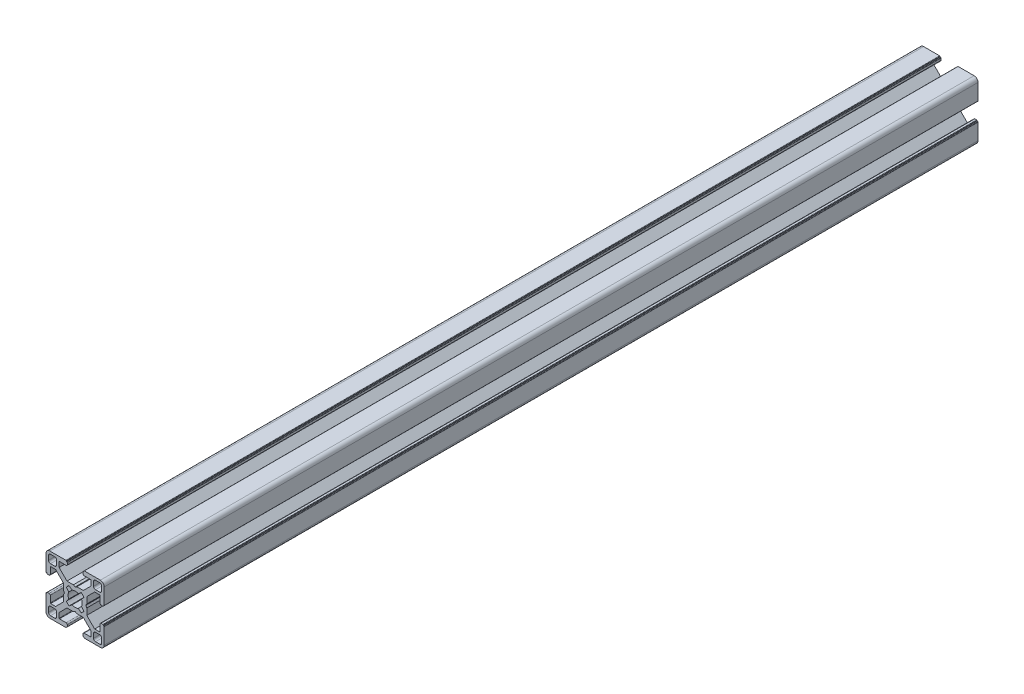
from build123d import *

# Parameters (mm, degrees)
DODANIE_WYCI_GNI_CIE1_DEPTH = 225


with BuildPart() as part:
    # Szkic1 → Dodanie-wyciągnięcie1 (new, symmetric)
    with BuildSketch(Plane.XY):
        with BuildLine():
            Line((0, -5.48), (0.90066642, -6))
            Line((0.90066642, -6), (4.203948776, -6))
            Line((4.203948776, -6), (8.25, -10.046051224))
            Line((8.25, -10.046051224), (8.25, -12.6))
            ThreePointArc((8.25, -12.6), (8.191421356, -12.741421356), (8.05, -12.8))
            Line((8.05, -12.8), (4.65, -12.8))
            ThreePointArc((4.65, -12.8), (4.225735931, -12.975735931), (4.05, -13.4))
            Line((4.05, -13.4), (4.05, -14.3))
            ThreePointArc((4.05, -14.3), (4.108578644, -14.441421356), (4.25, -14.5))
            Line((4.25, -14.5), (4.35, -14.5))
            ThreePointArc((4.35, -14.5), (4.491421356, -14.558578644), (4.55, -14.7))
            Line((4.55, -14.7), (4.55, -14.8))
            ThreePointArc((4.55, -14.8), (4.608578644, -14.941421356), (4.75, -15))
            Line((4.75, -15), (13, -15))
            ThreePointArc((13, -15), (14.414213562, -14.414213562), (15, -13))
            Line((15, -13), (15, -4.75))
            ThreePointArc((15, -4.75), (14.941421356, -4.608578644), (14.8, -4.55))
            Line((14.8, -4.55), (14.7, -4.55))
            ThreePointArc((14.7, -4.55), (14.558578644, -4.491421356), (14.5, -4.35))
            Line((14.5, -4.35), (14.5, -4.25))
            ThreePointArc((14.5, -4.25), (14.441421356, -4.108578644), (14.3, -4.05))
            Line((14.3, -4.05), (13.4, -4.05))
            ThreePointArc((13.4, -4.05), (12.975735931, -4.225735931), (12.8, -4.65))
            Line((12.8, -4.65), (12.8, -8.05))
            ThreePointArc((12.8, -8.05), (12.741421356, -8.191421356), (12.6, -8.25))
            Line((12.6, -8.25), (10.046051224, -8.25))
            Line((10.046051224, -8.25), (6, -4.203948776))
            Line((6, -4.203948776), (6, -0.90066642))
            Line((6, -0.90066642), (5.48, 0))
            Line((5.48, 0), (6, 0.90066642))
            Line((6, 0.90066642), (6, 4.203948776))
            Line((6, 4.203948776), (10.046051224, 8.25))
            Line((10.046051224, 8.25), (12.6, 8.25))
            ThreePointArc((12.6, 8.25), (12.741421356, 8.191421356), (12.8, 8.05))
            Line((12.8, 8.05), (12.8, 4.65))
            ThreePointArc((12.8, 4.65), (12.975735931, 4.225735931), (13.4, 4.05))
            Line((13.4, 4.05), (14.3, 4.05))
            ThreePointArc((14.3, 4.05), (14.441421356, 4.108578644), (14.5, 4.25))
            Line((14.5, 4.25), (14.5, 4.35))
            ThreePointArc((14.5, 4.35), (14.558578644, 4.491421356), (14.7, 4.55))
            Line((14.7, 4.55), (14.8, 4.55))
            ThreePointArc((14.8, 4.55), (14.941421356, 4.608578644), (15, 4.75))
            Line((15, 4.75), (15, 13))
            ThreePointArc((15, 13), (14.414213562, 14.414213562), (13, 15))
            Line((13, 15), (4.75, 15))
            ThreePointArc((4.75, 15), (4.608578644, 14.941421356), (4.55, 14.8))
            Line((4.55, 14.8), (4.55, 14.7))
            ThreePointArc((4.55, 14.7), (4.491421356, 14.558578644), (4.35, 14.5))
            Line((4.35, 14.5), (4.25, 14.5))
            ThreePointArc((4.25, 14.5), (4.108578644, 14.441421356), (4.05, 14.3))
            Line((4.05, 14.3), (4.05, 13.4))
            ThreePointArc((4.05, 13.4), (4.225735931, 12.975735931), (4.65, 12.8))
            Line((4.65, 12.8), (8.05, 12.8))
            ThreePointArc((8.05, 12.8), (8.191421356, 12.741421356), (8.25, 12.6))
            Line((8.25, 12.6), (8.25, 10.046051224))
            Line((8.25, 10.046051224), (4.203948776, 6))
            Line((4.203948776, 6), (0.90066642, 6))
            Line((0.90066642, 6), (0, 5.48))
            Line((0, 5.48), (-0.90066642, 6))
            Line((-0.90066642, 6), (-4.203948776, 6))
            Line((-4.203948776, 6), (-8.25, 10.046051224))
            Line((-8.25, 10.046051224), (-8.25, 12.6))
            ThreePointArc((-8.25, 12.6), (-8.191421356, 12.741421356), (-8.05, 12.8))
            Line((-8.05, 12.8), (-4.65, 12.8))
            ThreePointArc((-4.65, 12.8), (-4.225735931, 12.975735931), (-4.05, 13.4))
            Line((-4.05, 13.4), (-4.05, 14.3))
            ThreePointArc((-4.05, 14.3), (-4.108578644, 14.441421356), (-4.25, 14.5))
            Line((-4.25, 14.5), (-4.35, 14.5))
            ThreePointArc((-4.35, 14.5), (-4.491421356, 14.558578644), (-4.55, 14.7))
            Line((-4.55, 14.7), (-4.55, 14.8))
            ThreePointArc((-4.55, 14.8), (-4.608578644, 14.941421356), (-4.75, 15))
            Line((-4.75, 15), (-13, 15))
            ThreePointArc((-13, 15), (-14.414213562, 14.414213562), (-15, 13))
            Line((-15, 13), (-15, 4.75))
            ThreePointArc((-15, 4.75), (-14.941421356, 4.608578644), (-14.8, 4.55))
            Line((-14.8, 4.55), (-14.7, 4.55))
            ThreePointArc((-14.7, 4.55), (-14.558578644, 4.491421356), (-14.5, 4.35))
            Line((-14.5, 4.35), (-14.5, 4.25))
            ThreePointArc((-14.5, 4.25), (-14.441421356, 4.108578644), (-14.3, 4.05))
            Line((-14.3, 4.05), (-13.4, 4.05))
            ThreePointArc((-13.4, 4.05), (-12.975735931, 4.225735931), (-12.8, 4.65))
            Line((-12.8, 4.65), (-12.8, 8.05))
            ThreePointArc((-12.8, 8.05), (-12.741421356, 8.191421356), (-12.6, 8.25))
            Line((-12.6, 8.25), (-10.046051224, 8.25))
            Line((-10.046051224, 8.25), (-6, 4.203948776))
            Line((-6, 4.203948776), (-6, 0.90066642))
            Line((-6, 0.90066642), (-5.48, 0))
            Line((-5.48, 0), (-6, -0.90066642))
            Line((-6, -0.90066642), (-6, -4.203948776))
            Line((-6, -4.203948776), (-10.046051224, -8.25))
            Line((-10.046051224, -8.25), (-12.6, -8.25))
            ThreePointArc((-12.6, -8.25), (-12.741421356, -8.191421356), (-12.8, -8.05))
            Line((-12.8, -8.05), (-12.8, -4.65))
            ThreePointArc((-12.8, -4.65), (-12.975735931, -4.225735931), (-13.4, -4.05))
            Line((-13.4, -4.05), (-14.3, -4.05))
            ThreePointArc((-14.3, -4.05), (-14.441421356, -4.108578644), (-14.5, -4.25))
            Line((-14.5, -4.25), (-14.5, -4.35))
            ThreePointArc((-14.5, -4.35), (-14.558578644, -4.491421356), (-14.7, -4.55))
            Line((-14.7, -4.55), (-14.8, -4.55))
            ThreePointArc((-14.8, -4.55), (-14.941421356, -4.608578644), (-15, -4.75))
            Line((-15, -4.75), (-15, -13))
            ThreePointArc((-15, -13), (-14.414213562, -14.414213562), (-13, -15))
            Line((-13, -15), (-4.75, -15))
            ThreePointArc((-4.75, -15), (-4.608578644, -14.941421356), (-4.55, -14.8))
            Line((-4.55, -14.8), (-4.55, -14.7))
            ThreePointArc((-4.55, -14.7), (-4.491421356, -14.558578644), (-4.35, -14.5))
            Line((-4.35, -14.5), (-4.25, -14.5))
            ThreePointArc((-4.25, -14.5), (-4.108578644, -14.441421356), (-4.05, -14.3))
            Line((-4.05, -14.3), (-4.05, -13.4))
            ThreePointArc((-4.05, -13.4), (-4.225735931, -12.975735931), (-4.65, -12.8))
            Line((-4.65, -12.8), (-8.05, -12.8))
            ThreePointArc((-8.05, -12.8), (-8.191421356, -12.741421356), (-8.25, -12.6))
            Line((-8.25, -12.6), (-8.25, -10.046051224))
            Line((-8.25, -10.046051224), (-4.203948776, -6))
            Line((-4.203948776, -6), (-0.90066642, -6))
            Line((-0.90066642, -6), (0, -5.48))
        make_face()
        with BuildLine():
            Line((12.7, 13.7), (10.5, 13.7))
            ThreePointArc((10.5, 13.7), (9.792893219, 13.407106781), (9.5, 12.7))
            Line((9.5, 12.7), (9.5, 10.5))
            ThreePointArc((9.5, 10.5), (9.792893219, 9.792893219), (10.5, 9.5))
            Line((10.5, 9.5), (12.7, 9.5))
            ThreePointArc((12.7, 9.5), (13.407106781, 9.792893219), (13.7, 10.5))
            Line((13.7, 10.5), (13.7, 12.7))
            ThreePointArc((13.7, 12.7), (13.407106781, 13.407106781), (12.7, 13.7))
        make_face(mode=Mode.SUBTRACT)
        with BuildLine():
            Line((-1.58286583, 3.288926233), (-3.117157854, 4.531371416))
            ThreePointArc((-3.117157854, 4.531371416), (-3.889087297, 3.889087297), (-4.531371416, 3.117157854))
            Line((-4.531371416, 3.117157854), (-3.288926233, 1.58286583))
            ThreePointArc((-3.288926233, 1.58286583), (-3.65, 0), (-3.288926233, -1.58286583))
            Line((-3.288926233, -1.58286583), (-4.531371416, -3.117157854))
            ThreePointArc((-4.531371416, -3.117157854), (-3.889087297, -3.889087297), (-3.117157854, -4.531371416))
            Line((-3.117157854, -4.531371416), (-1.58286583, -3.288926233))
            ThreePointArc((-1.58286583, -3.288926233), (0, -3.65), (1.58286583, -3.288926233))
            Line((1.58286583, -3.288926233), (3.117157854, -4.531371416))
            ThreePointArc((3.117157854, -4.531371416), (3.889087297, -3.889087297), (4.531371416, -3.117157854))
            Line((4.531371416, -3.117157854), (3.288926233, -1.58286583))
            ThreePointArc((3.288926233, -1.58286583), (3.65, 0), (3.288926233, 1.58286583))
            Line((3.288926233, 1.58286583), (4.531371416, 3.117157854))
            ThreePointArc((4.531371416, 3.117157854), (3.889087297, 3.889087297), (3.117157854, 4.531371416))
            Line((3.117157854, 4.531371416), (1.58286583, 3.288926233))
            ThreePointArc((1.58286583, 3.288926233), (0, 3.65), (-1.58286583, 3.288926233))
        make_face(mode=Mode.SUBTRACT)
        with BuildLine():
            Line((-12.7, -13.7), (-10.5, -13.7))
            ThreePointArc((-10.5, -13.7), (-9.792893219, -13.407106781), (-9.5, -12.7))
            Line((-9.5, -12.7), (-9.5, -10.5))
            ThreePointArc((-9.5, -10.5), (-9.792893219, -9.792893219), (-10.5, -9.5))
            Line((-10.5, -9.5), (-12.7, -9.5))
            ThreePointArc((-12.7, -9.5), (-13.407106781, -9.792893219), (-13.7, -10.5))
            Line((-13.7, -10.5), (-13.7, -12.7))
            ThreePointArc((-13.7, -12.7), (-13.407106781, -13.407106781), (-12.7, -13.7))
        make_face(mode=Mode.SUBTRACT)
        with BuildLine():
            Line((13.7, -12.7), (13.7, -10.5))
            ThreePointArc((13.7, -10.5), (13.407106781, -9.792893219), (12.7, -9.5))
            Line((12.7, -9.5), (10.5, -9.5))
            ThreePointArc((10.5, -9.5), (9.792893219, -9.792893219), (9.5, -10.5))
            Line((9.5, -10.5), (9.5, -12.7))
            ThreePointArc((9.5, -12.7), (9.792893219, -13.407106781), (10.5, -13.7))
            Line((10.5, -13.7), (12.7, -13.7))
            ThreePointArc((12.7, -13.7), (13.407106781, -13.407106781), (13.7, -12.7))
        make_face(mode=Mode.SUBTRACT)
        with BuildLine():
            Line((-10.5, 13.7), (-12.7, 13.7))
            ThreePointArc((-12.7, 13.7), (-13.407106781, 13.407106781), (-13.7, 12.7))
            Line((-13.7, 12.7), (-13.7, 10.5))
            ThreePointArc((-13.7, 10.5), (-13.407106781, 9.792893219), (-12.7, 9.5))
            Line((-12.7, 9.5), (-10.5, 9.5))
            ThreePointArc((-10.5, 9.5), (-9.792893219, 9.792893219), (-9.5, 10.5))
            Line((-9.5, 10.5), (-9.5, 12.7))
            ThreePointArc((-9.5, 12.7), (-9.792893219, 13.407106781), (-10.5, 13.7))
        make_face(mode=Mode.SUBTRACT)
    extrude(amount=DODANIE_WYCI_GNI_CIE1_DEPTH, both=True)


solid = part.part
